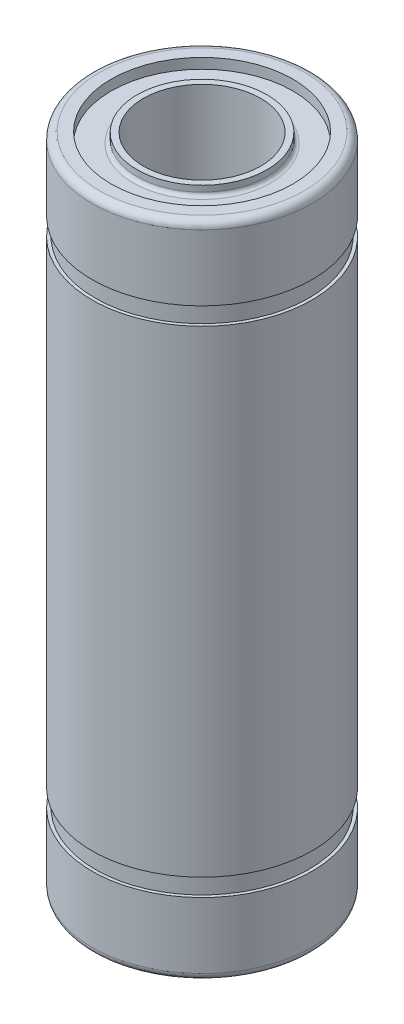
from build123d import *


with BuildPart() as part:
    # Sketch1 → Revolve1 (revolve)
    with BuildSketch(Plane.XY, mode=Mode.PRIVATE) as revolve1_sk:
        with BuildLine():
            Line((4.425, 22.4004), (4, 22.4004))
            Line((4, 22.4004), (4, -22.4004))
            Line((4, -22.4004), (4.425, -22.4004))
            Line((4.425, -22.4004), (4.425, -21.994))
            ThreePointArc((4.425, -21.994), (4.499394878, -21.814394878), (4.679, -21.74))
            Line((4.679, -21.74), (6.19, -21.74))
            Line((6.19, -21.74), (6.19, -22.44))
            Line((6.19, -22.44), (6.982, -22.44))
            ThreePointArc((6.982, -22.44), (7.341210245, -22.291210245), (7.49, -21.932))
            Line((7.49, -21.932), (7.49, -17.45))
            Line((7.49, -17.45), (7.275, -17.45))
            Line((7.275, -17.45), (7.275, -16.25))
            Line((7.275, -16.25), (7.49, -16.25))
            Line((7.49, -16.25), (7.49, 16.25))
            Line((7.49, 16.25), (7.275, 16.25))
            Line((7.275, 16.25), (7.275, 17.45))
            Line((7.275, 17.45), (7.49, 17.45))
            Line((7.49, 17.45), (7.49, 21.932))
            ThreePointArc((7.49, 21.932), (7.341210245, 22.291210245), (6.982, 22.44))
            Line((6.982, 22.44), (6.19, 22.44))
            Line((6.19, 22.44), (6.19, 21.74))
            Line((6.19, 21.74), (4.679, 21.74))
            ThreePointArc((4.679, 21.74), (4.499394878, 21.814394878), (4.425, 21.994))
            Line((4.425, 21.994), (4.425, 22.4004))
        make_face()
    revolve(revolve1_sk.sketch.rotate(Axis((0, 22.441250002, 0), (0, -1, 0)), 270), axis=Axis((0, 22.441250002, 0), (0, -1, 0)))


solid = part.part
